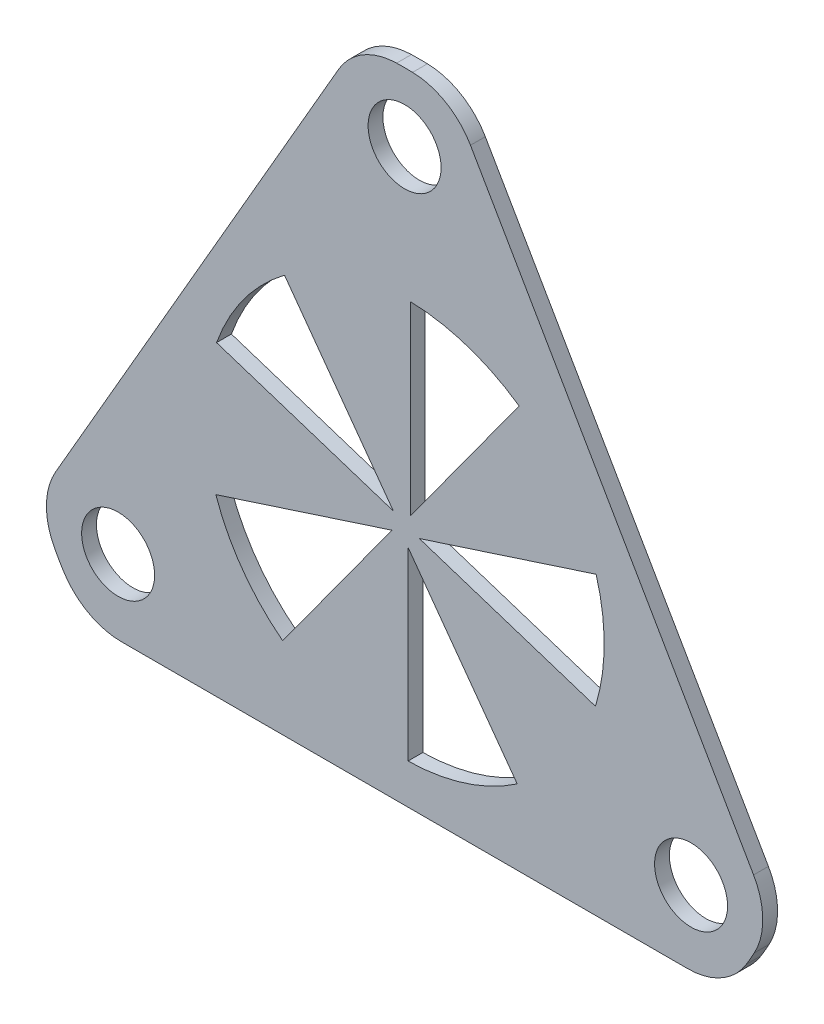
from build123d import *

# Parameters (mm, degrees)
SKETCH2_R           = 19
BOSS_EXTRUDE1_DEPTH = 1.3
BOSS_EXTRUDE7_START = -1.3
BOSS_EXTRUDE7_DEPTH = 1.3
SKETCH17_R          = 0.7
BOSS_EXTRUDE9_DEPTH = 1.3
BOSS_EXTRUDE2_START = -1.3
SKETCH3_R           = 35
SKETCH3_R_2         = 19
BOSS_EXTRUDE2_DEPTH = 1.3
SKETCH6_R           = 5
BOSS_EXTRUDE4_DEPTH = 1
SKETCH7_R           = 59.131365533
CUT_EXTRUDE1_DEPTH  = 10
FILLET1_R           = 6
SKETCH4_R           = 3.2
CUT_EXTRUDE2_DEPTH  = 10


with BuildPart() as part:
    # Sketch2 → Boss-Extrude1 (new body)
    with BuildSketch(Plane.XY.offset(10)):
        Circle(SKETCH2_R)
        with BuildLine():
            ThreePointArc((0, 0.943688479), (0.291615777, 0.897501077), (0.554686171, 0.763460017))
            Line((0.554686171, 0.763460017), (10.580134541, 14.562305899))
            ThreePointArc((10.580134541, 14.562305899), (14.562305899, 10.580134541), (17.119017293, 5.562305899))
            Line((17.119017293, 5.562305899), (0.897501077, 0.291615777))
            ThreePointArc((0.897501077, 0.291615777), (0.943688479, 0), (0.897501077, -0.291615777))
            Line((0.897501077, -0.291615777), (17.119017293, -5.562305899))
            ThreePointArc((17.119017293, -5.562305899), (14.562305899, -10.580134541), (10.580134541, -14.562305899))
            Line((10.580134541, -14.562305899), (0.554686171, -0.763460017))
            ThreePointArc((0.554686171, -0.763460017), (0.291615777, -0.897501077), (0, -0.943688479))
            Line((0, -0.943688479), (0, -18))
            ThreePointArc((0, -18), (-5.562305899, -17.119017293), (-10.580134541, -14.562305899))
            Line((-10.580134541, -14.562305899), (-0.554686171, -0.763460017))
            ThreePointArc((-0.554686171, -0.763460017), (-0.763460017, -0.554686171), (-0.897501077, -0.291615777))
            Line((-0.897501077, -0.291615777), (-17.119017293, -5.562305899))
            ThreePointArc((-17.119017293, -5.562305899), (-18, 0), (-17.119017293, 5.562305899))
            Line((-17.119017293, 5.562305899), (-0.897501077, 0.291615777))
            ThreePointArc((-0.897501077, 0.291615777), (-0.763460017, 0.554686171), (-0.554686171, 0.763460017))
            Line((-0.554686171, 0.763460017), (-10.580134541, 14.562305899))
            ThreePointArc((-10.580134541, 14.562305899), (-5.562305899, 17.119017293), (0, 18))
            Line((0, 18), (0, 0.943688479))
        make_face(mode=Mode.SUBTRACT)
        with BuildLine():
            Line((0.5, 1.198581445), (0.5, 17.492855685))
            ThreePointArc((0.5, 17.492855685), (5.50283957, 16.612307385), (10.042025258, 14.332052495))
            Line((10.042025258, 14.332052495), (0.5, 1.198581445))
        make_face(mode=Mode.SUBTRACT)
        with BuildLine():
            Line((-0.985410197, 0.845910294), (-16.48218589, 5.881117945))
            ThreePointArc((-16.48218589, 5.881117945), (-14.098772245, 10.366996729), (-10.527435455, 13.979381344))
            Line((-10.527435455, 13.979381344), (-0.985410197, 0.845910294))
        make_face(mode=Mode.SUBTRACT)
        with BuildLine():
            Line((-1.109016994, -0.675780132), (-10.686551089, -13.858124903))
            ThreePointArc((-10.686551089, -13.858124903), (-14.216360017, -10.205151045), (-16.548338183, -5.692319683))
            Line((-16.548338183, -5.692319683), (-1.109016994, -0.675780132))
        make_face(mode=Mode.SUBTRACT)
        with BuildLine():
            ThreePointArc((9.877534095, -14.445910155), (5.312578558, -16.674126936), (0.3, -17.497428382))
            Line((0.3, -17.497428382), (0.3, -1.263565384))
            Line((0.3, -1.263565384), (9.877534095, -14.445910155))
        make_face(mode=Mode.SUBTRACT)
        with BuildLine():
            Line((16.73374838, -5.121685773), (1.294427191, -0.105146222))
            Line((1.294427191, -0.105146222), (16.791202885, 4.930061429))
            ThreePointArc((16.791202885, 4.930061429), (17.499714134, -0.100026134), (16.73374838, -5.121685773))
        make_face(mode=Mode.SUBTRACT)
    extrude(amount=-BOSS_EXTRUDE1_DEPTH)

    # Sketch11 → Boss-Extrude7 (add)
    with BuildSketch(Plane(origin=(0, 0, 8.7), x_dir=(-1, 0, 0), z_dir=(0, 0, -1)).offset(BOSS_EXTRUDE7_START)):
        with BuildLine():
            ThreePointArc((-0.897501077, 0.291615777), (-0.763460017, 0.554686171), (-0.554686171, 0.763460017))
            Line((-0.554686171, 0.763460017), (-10.580134541, 14.562305899))
            ThreePointArc((-10.580134541, 14.562305899), (-14.562305899, 10.580134541), (-17.119017293, 5.562305899))
            Line((-17.119017293, 5.562305899), (-0.897501077, 0.291615777))
        make_face()
        with BuildLine():
            Line((0, 18), (0, 0.943688479))
            ThreePointArc((0, 0.943688479), (0.291615777, 0.897501077), (0.554686171, 0.763460017))
            Line((0.554686171, 0.763460017), (10.580134541, 14.562305899))
            ThreePointArc((10.580134541, 14.562305899), (5.562305899, 17.119017293), (0, 18))
        make_face()
        with BuildLine():
            Line((17.119017293, 5.562305899), (0.897501077, 0.291615777))
            ThreePointArc((0.897501077, 0.291615777), (0.932070108, 0.147625402), (0.943688479, 0))
            ThreePointArc((0.943688479, 0), (0.932070108, -0.147625402), (0.897501077, -0.291615777))
            Line((0.897501077, -0.291615777), (17.119017293, -5.562305899))
            ThreePointArc((17.119017293, -5.562305899), (18, 0), (17.119017293, 5.562305899))
        make_face()
        with BuildLine():
            Line((10.580134541, -14.562305899), (0.554686171, -0.763460017))
            ThreePointArc((0.554686171, -0.763460017), (0.291615777, -0.897501077), (0, -0.943688479))
            Line((0, -0.943688479), (0, -18))
            ThreePointArc((0, -18), (5.562305899, -17.119017293), (10.580134541, -14.562305899))
        make_face()
        with BuildLine():
            ThreePointArc((-0.554686171, -0.763460017), (-0.763460017, -0.554686171), (-0.897501077, -0.291615777))
            Line((-0.897501077, -0.291615777), (-17.119017293, -5.562305899))
            ThreePointArc((-17.119017293, -5.562305899), (-14.562305899, -10.580134541), (-10.580134541, -14.562305899))
            Line((-10.580134541, -14.562305899), (-0.554686171, -0.763460017))
        make_face()
        with BuildLine():
            ThreePointArc((0.554686171, 0.763460017), (0.291615777, 0.897501077), (0, 0.943688479))
            ThreePointArc((0, 0.943688479), (-0.291615777, 0.897501077), (-0.554686171, 0.763460017))
            ThreePointArc((-0.554686171, 0.763460017), (-0.763460017, 0.554686171), (-0.897501077, 0.291615777))
            ThreePointArc((-0.897501077, 0.291615777), (-0.943688479, 0), (-0.897501077, -0.291615777))
            ThreePointArc((-0.897501077, -0.291615777), (-0.763460017, -0.554686171), (-0.554686171, -0.763460017))
            ThreePointArc((-0.554686171, -0.763460017), (-0.291615777, -0.897501077), (0, -0.943688479))
            ThreePointArc((0, -0.943688479), (0.291615777, -0.897501077), (0.554686171, -0.763460017))
            ThreePointArc((0.554686171, -0.763460017), (0.763460017, -0.554686171), (0.897501077, -0.291615777))
            ThreePointArc((0.897501077, -0.291615777), (0.932070108, -0.147625402), (0.943688479, 0))
            ThreePointArc((0.943688479, 0), (0.932070108, 0.147625402), (0.897501077, 0.291615777))
            ThreePointArc((0.897501077, 0.291615777), (0.763460017, 0.554686171), (0.554686171, 0.763460017))
        make_face()
    extrude(amount=BOSS_EXTRUDE7_DEPTH)

    # Sketch17 → Boss-Extrude9 (add)
    with BuildSketch(Plane(origin=(0, 0, 8.7), x_dir=(-1, 0, 0), z_dir=(0, 0, -1))):
        Circle(SKETCH17_R)
    extrude(amount=-BOSS_EXTRUDE9_DEPTH)

    # Sketch3 → Boss-Extrude2 (add)
    with BuildSketch(Plane(origin=(0, 0, 8.7), x_dir=(-1, 0, 0), z_dir=(0, 0, -1)).offset(BOSS_EXTRUDE2_START)):
        Circle(SKETCH3_R)
        Circle(SKETCH3_R_2, mode=Mode.SUBTRACT)
    extrude(amount=BOSS_EXTRUDE2_DEPTH)

    # Sketch6 → Boss-Extrude4 (add)
    with BuildSketch(Plane(origin=(0, 0, 10), x_dir=(-1, 0, 0), z_dir=(0, 0, -1))):
        with Locations((0, 30)):
            Circle(SKETCH6_R)
        with Locations((25.980762114, -15)):
            Circle(SKETCH6_R)
        with Locations((-25.980762114, -15)):
            Circle(SKETCH6_R)
    extrude(amount=BOSS_EXTRUDE4_DEPTH)

    # Sketch7 → Cut-Extrude1 (cut)
    with BuildSketch(Plane(origin=(0, 0, 8.7), x_dir=(-1, 0, 0), z_dir=(0, 0, -1))):
        Circle(SKETCH7_R)
        Polygon((0, 42), (-36.373066959, -21), (36.373066959, -21), align=None, mode=Mode.SUBTRACT)
    extrude(amount=-CUT_EXTRUDE1_DEPTH, mode=Mode.SUBTRACT)

    # Fillet1
    fillet1_edges = [part.edges().sort_by_distance(p)[0] for p in [
        (4.186533479, 34.748711306, 9.35),
        (32.186533479, -13.748711306, 9.35),
        (28, -21, 9.35),
        (-28, -21, 9.35),
        (-32.186533479, -13.748711306, 9.35),
        (-4.186533479, 34.748711306, 9.35),
    ]]
    fillet(fillet1_edges, radius=FILLET1_R)

    # Sketch4 → Cut-Extrude2 (cut)
    with BuildSketch(Plane(origin=(0, 0, 8.7), x_dir=(-1, 0, 0), z_dir=(0, 0, -1))):
        with Locations((0, 29)):
            Circle(SKETCH4_R)
        with Locations((25.11473671, -14.5)):
            Circle(SKETCH4_R)
        with Locations((-25.11473671, -14.5)):
            Circle(SKETCH4_R)
    extrude(amount=-CUT_EXTRUDE2_DEPTH, mode=Mode.SUBTRACT)


solid = part.part
